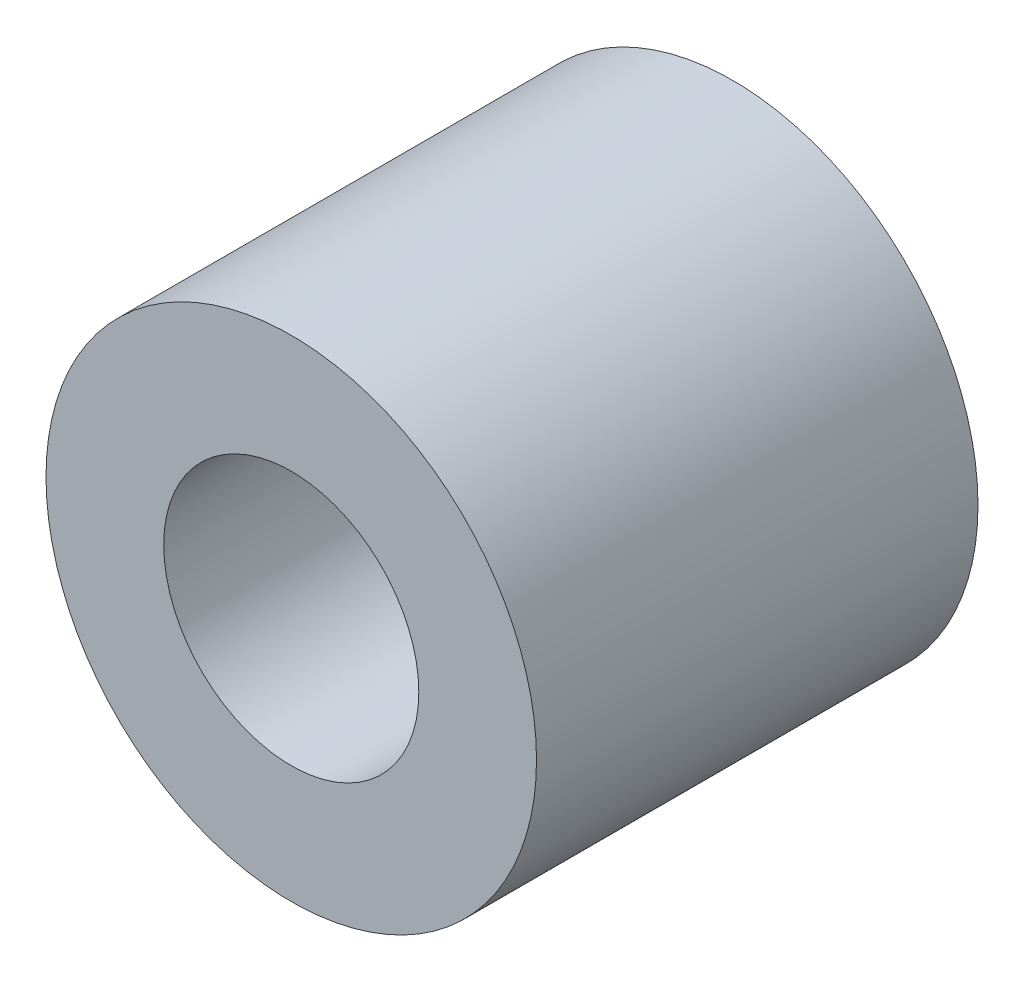
from build123d import *

# Parameters (mm, degrees)
SKETCH1_R           = 5
SKETCH1_R_2         = 2.6
BOSS_EXTRUDE1_DEPTH = 9


with BuildPart() as part:
    # Sketch1 → Boss-Extrude1 (new body)
    with BuildSketch(Plane.XY):
        Circle(SKETCH1_R)
        Circle(SKETCH1_R_2, mode=Mode.SUBTRACT)
    extrude(amount=BOSS_EXTRUDE1_DEPTH)


solid = part.part
